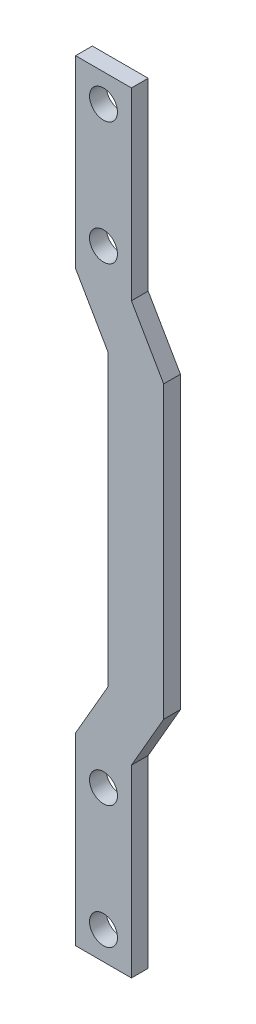
from build123d import *

# Parameters (mm, degrees)
ESQUISSE1_R        = 2.5
BOSS_EXTRU_1_DEPTH = 3


with BuildPart() as part:
    # Esquisse1 → Boss.-Extru.1 (new body)
    with BuildSketch(Plane.XY):
        Polygon((-100.080131723, 30.264285714), (-100.080131723, 63.264285714), (-110.080131723, 63.264285714), (-110.080131723, 30.264285714), (-104.306629031, 20.264285714), (-104.306629031, -31.735714286), (-110.080131723, -41.735714286), (-110.080131723, -74.735714286), (-100.080131723, -74.735714286), (-100.080131723, -41.735714286), (-94.306629031, -31.735714286), (-94.306629031, 20.264285714), align=None)
        with Locations((-105.080131723, 58.264285714)):
            Circle(ESQUISSE1_R, mode=Mode.SUBTRACT)
        with Locations((-105.080131723, 36.264285714)):
            Circle(ESQUISSE1_R, mode=Mode.SUBTRACT)
        with Locations(Location((-105.080131723, -47.735714286, 0), (0, 0, 180))):
            Circle(ESQUISSE1_R, mode=Mode.SUBTRACT)
        with Locations(Location((-105.080131723, -69.735714286, 0), (0, 0, 180))):
            Circle(ESQUISSE1_R, mode=Mode.SUBTRACT)
    extrude(amount=BOSS_EXTRU_1_DEPTH)


solid = part.part
